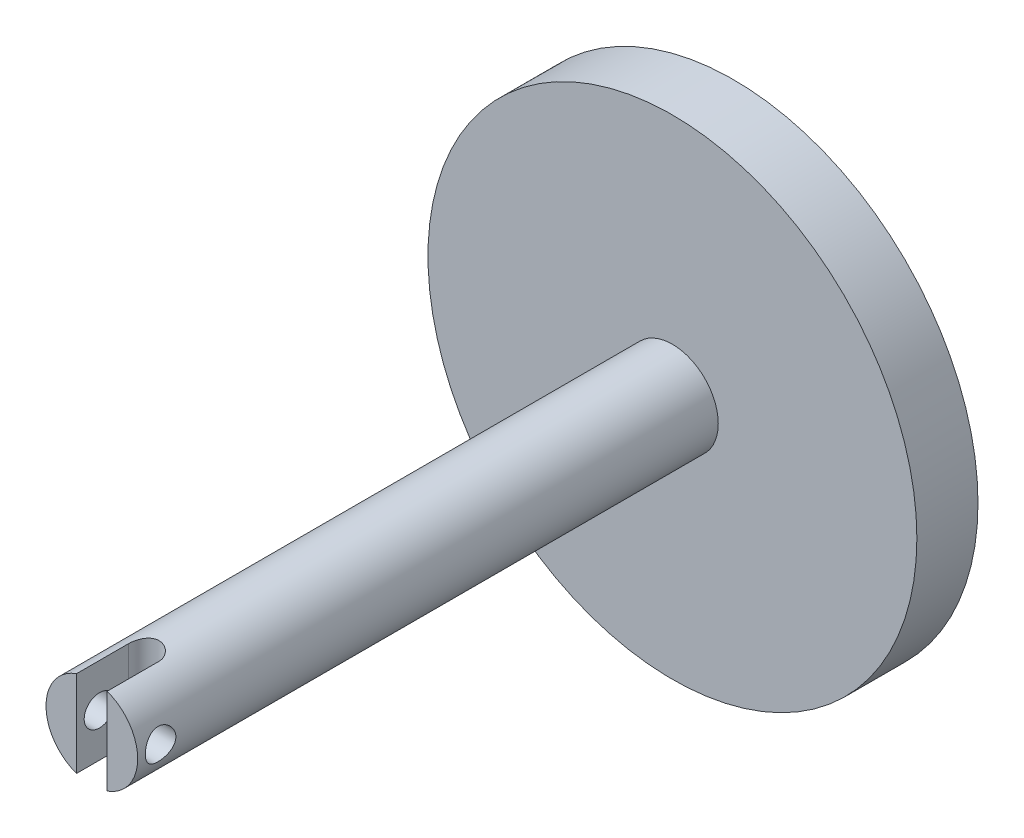
from build123d import *

# Parameters (mm, degrees)
SKETCH1_R           = 40
BOSS_EXTRUDE1_DEPTH = 10
SKETCH12_R          = 15
BOSS_EXTRUDE3_DEPTH = 10
SKETCH13_R          = 7.5
BOSS_EXTRUDE4_DEPTH = 95
CUT_EXTRUDE1_DEPTH  = 120.268604419
SKETCH17_R          = 2.5
CUT_EXTRUDE3_DEPTH  = 120.268604507
SKETCH18_R          = 1.5
CUT_EXTRUDE4_DEPTH  = 120.268604507


with BuildPart() as part:
    # Sketch1 → Boss-Extrude1 (new body)
    with BuildSketch(Plane.XY):
        Circle(SKETCH1_R)
    extrude(amount=BOSS_EXTRUDE1_DEPTH)

    # Sketch12 → Boss-Extrude3 (add)
    with BuildSketch(Plane(origin=(0, 0, 0), x_dir=(-1, 0, 0), z_dir=(0, 0, -1))):
        with Locations(Location((0, 0, 0), (0, 0, 180))):
            Circle(SKETCH12_R)
    extrude(amount=BOSS_EXTRUDE3_DEPTH)

    # Sketch13 → Boss-Extrude4 (add)
    with BuildSketch(Plane.XY.offset(10)):
        Circle(SKETCH13_R)
    extrude(amount=BOSS_EXTRUDE4_DEPTH)

    # Sketch14 → Cut-Extrude1 (cut, through all)
    with BuildSketch(Plane(origin=(0, 0, 0), x_dir=(1, 0, 0), z_dir=(0, 1, 0))):
        with BuildLine():
            Line((-2.5, -105), (2.5, -105))
            Line((2.5, -105), (2.5, -96.5))
            ThreePointArc((2.5, -96.5), (0, -94), (-2.5, -96.5))
            Line((-2.5, -96.5), (-2.5, -105))
        make_face()
    cut_extrude1 = extrude(amount=CUT_EXTRUDE1_DEPTH, mode=Mode.SUBTRACT)

    # Mirror4: Cut-Extrude1 across plane
    add(cut_extrude1.mirror(Plane.ZX), mode=Mode.SUBTRACT)

    # Sketch17 → Cut-Extrude3 (cut, through all)
    with BuildSketch(Plane(origin=(0, 0, 0), x_dir=(0, 0, -1), z_dir=(1, 0, 0))):
        with Locations((-101.25, 0)):
            Circle(SKETCH17_R)
    cut_extrude3 = extrude(amount=-CUT_EXTRUDE3_DEPTH, mode=Mode.SUBTRACT)

    # Mirror6: Cut-Extrude3 across plane
    add(cut_extrude3.mirror(Plane(origin=(0, 0, 0), x_dir=(0, 0, 1), z_dir=(1, 0, 0))), mode=Mode.SUBTRACT)

    # Sketch18 → Cut-Extrude4 (cut, through all)
    with BuildSketch(Plane(origin=(0, 0, 0), x_dir=(0, 0, -1), z_dir=(1, 0, 0))):
        with Locations((-5, 0)):
            Circle(SKETCH18_R)
    extrude(amount=-CUT_EXTRUDE4_DEPTH, mode=Mode.SUBTRACT)


solid = part.part
